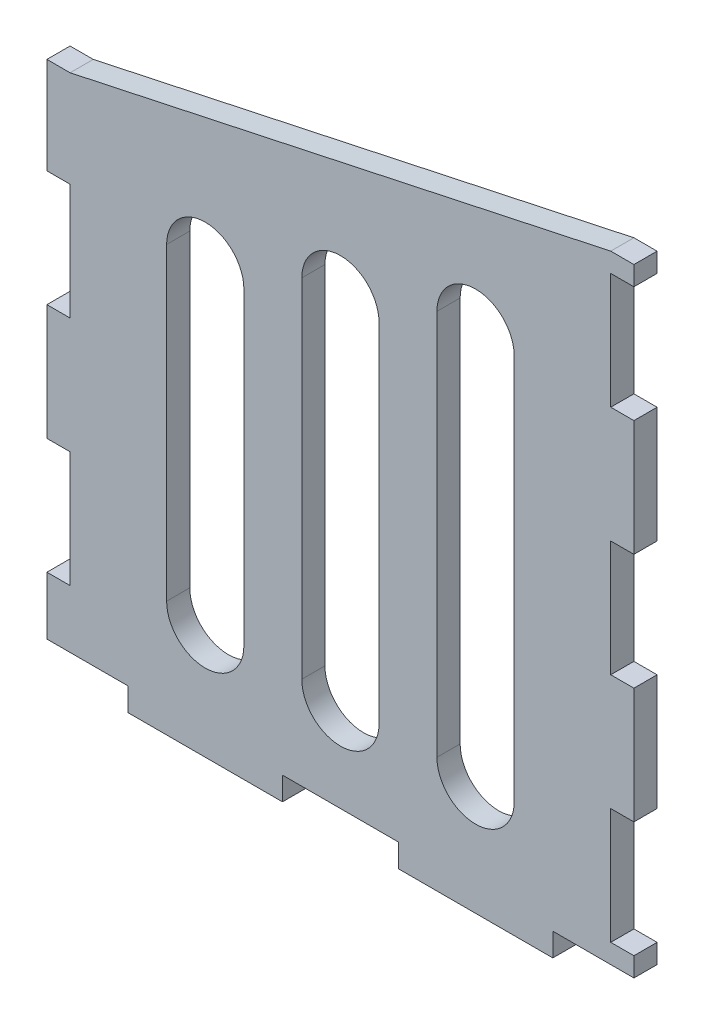
from build123d import *

# Parameters (mm, degrees)
SKETCH1_W           = 20
SKETCH1_H           = 3
BOSS_EXTRUDE1_DEPTH = 3


with BuildPart() as part:
    # Sketch1 → Boss-Extrude1 (new body)
    # profile 1 of 3: a face of its own
    with BuildSketch(Plane.XY):
        Polygon((35, 40), (-35, 25), (-38, 25), (-38, 12.5), (-35, 12.5), (-35, -2.5), (-38, -2.5), (-38, -17.5), (-35, -17.5), (-35, -32.5), (-38, -32.5), (-38, -40), (-27.5, -40), (-7.5, -40), (7.5, -40), (27.5, -40), (38, -40), (38, -37.5), (35, -37.5), (35, -22.5), (38, -22.5), (38, -7.5), (35, -7.5), (35, 7.5), (38, 7.5), (38, 22.5), (35, 22.5), (35, 37.5), (38, 37.5), (38, 40), align=None)
        with BuildLine():
            ThreePointArc((-12.5, -28), (-17.5, -33), (-22.5, -28))
            Line((-22.5, -28), (-22.5, 12))
            ThreePointArc((-22.5, 12), (-17.5, 17), (-12.5, 12))
            Line((-12.5, 12), (-12.5, -28))
        make_face(mode=Mode.SUBTRACT)
        with BuildLine():
            ThreePointArc((-5, 17), (0, 22), (5, 17))
            Line((5, 17), (5, -28))
            ThreePointArc((5, -28), (0, -33), (-5, -28))
            Line((-5, -28), (-5, 17))
        make_face(mode=Mode.SUBTRACT)
        with BuildLine():
            ThreePointArc((22.5, -28), (17.5, -33), (12.5, -28))
            Line((12.5, -28), (12.5, 22))
            ThreePointArc((12.5, 22), (17.5, 27), (22.5, 22))
            Line((22.5, 22), (22.5, -28))
        make_face(mode=Mode.SUBTRACT)
    # profile 2 of 3: a face of its own
    with BuildSketch(Plane.XY):
        with Locations((17.5, -41.5)):
            Rectangle(SKETCH1_W, SKETCH1_H)
    # profile 3 of 3: a face of its own
    with BuildSketch(Plane.XY):
        with Locations((-17.5, -41.5)):
            Rectangle(SKETCH1_W, SKETCH1_H)
    extrude(amount=BOSS_EXTRUDE1_DEPTH)


solid = part.part
